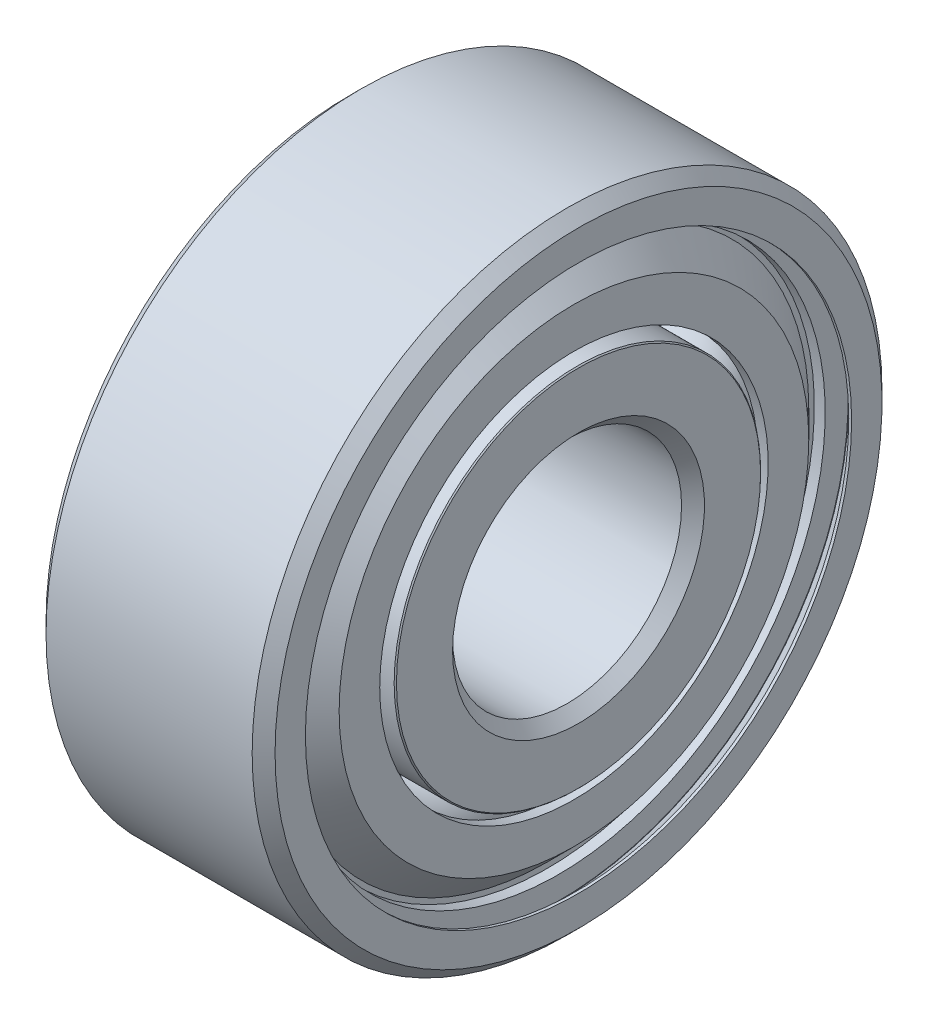
from build123d import *
from build123d.topology import SkipClean

# Parameters (mm, degrees)
SKETCH1_4_W       = 0.19
SKETCH1_4_H       = 0.4
CIRPATTERN2_COUNT = 8


with BuildPart() as part:
    # Sketch1 → Revolve1 (revolve)
    with BuildSketch(Plane.XY, mode=Mode.PRIVATE) as revolve1_sk:
        with BuildLine():
            ThreePointArc((1.00871205, 4.5), (0, 5.05), (-1.00871205, 4.5))
            Line((-1.00871205, 4.5), (-1.25, 4.5))
            Line((-1.25, 4.5), (-1.25, 4.77))
            Line((-1.25, 4.77), (-1.45, 4.77))
            Line((-1.45, 4.77), (-1.45, 5.07))
            Line((-1.45, 5.07), (-1.65, 5.07))
            Line((-1.65, 5.07), (-1.95, 4.77))
            Line((-1.95, 4.77), (-2, 4.77))
            Line((-2, 4.77), (-2, 5.3))
            Line((-2, 5.3), (-1.8, 5.5))
            Line((-1.8, 5.5), (1.8, 5.5))
            Line((1.8, 5.5), (2, 5.3))
            Line((2, 5.3), (2, 4.77))
            Line((2, 4.77), (1.95, 4.77))
            Line((1.95, 4.77), (1.65, 5.07))
            Line((1.65, 5.07), (1.45, 5.07))
            Line((1.45, 5.07), (1.45, 4.77))
            Line((1.45, 4.77), (1.25, 4.77))
            Line((1.25, 4.77), (1.25, 4.5))
            Line((1.25, 4.5), (1.00871205, 4.5))
        make_face()
        with BuildLine():
            ThreePointArc((-1.00871205, 3.2), (0, 2.65), (1.00871205, 3.2))
            Line((1.00871205, 3.2), (1.98, 3.2))
            Line((1.98, 3.2), (2, 3.18))
            Line((2, 3.18), (2, 2.2))
            Line((2, 2.2), (1.8, 2))
            Line((1.8, 2), (-1.8, 2))
            Line((-1.8, 2), (-2, 2.2))
            Line((-2, 2.2), (-2, 3.18))
            Line((-2, 3.18), (-1.98, 3.2))
            Line((-1.98, 3.2), (-1.00871205, 3.2))
        make_face()
    revolve(revolve1_sk.sketch.rotate(Axis((0, 0, 0), (1, 0, 0)), 90), axis=Axis((0, 0, 0), (1, 0, 0)))


with BuildPart() as body_2:
    # Sketch1<3> → Revolve2 (revolve)
    with BuildSketch(Plane.XY, mode=Mode.PRIVATE) as revolve2_sk:
        Polygon((1.92036514, 4.101237783), (1.92036514, 3.392543849), (1.74036514, 3.392543849), (1.74036514, 4.026679342), (1.267044482, 4.5), (1.267044482, 4.756515811), (1.447044482, 4.756515811), (1.447044482, 4.574558441), align=None)
        Polygon((-1.267044482, 4.5), (-1.267044482, 4.756515811), (-1.447044482, 4.756515811), (-1.447044482, 4.574558441), (-1.92036514, 4.101237783), (-1.92036514, 3.392543849), (-1.74036514, 3.392543849), (-1.74036514, 4.026679342), align=None)
    revolve(revolve2_sk.sketch.rotate(Axis((0, 0, 0), (1, 0, 0)), 90), axis=Axis((0, 0, 0), (1, 0, 0)))


with BuildPart() as body_3:
    # Sketch1<4> → Revolve3 (revolve)
    with BuildSketch(Plane.XY, mode=Mode.PRIVATE) as revolve3_sk:
        with Locations((1.553908134, 4.860421419)):
            Rectangle(SKETCH1_4_W, SKETCH1_4_H)
        with Locations((-1.553908134, 4.860421419)):
            Rectangle(SKETCH1_4_W, SKETCH1_4_H)
    revolve(revolve3_sk.sketch.rotate(Axis((0, 0, 0), (1, 0, 0)), 90), axis=Axis((0, 0, 0), (1, 0, 0)))


with BuildPart() as body_4:
    # Sketch1<5> → Revolve4 (revolve)
    with SkipClean():  # the faces are left unmerged after this step: merging them gives an invalid solid
        with BuildSketch(Plane.XY):
            with BuildLine():
                ThreePointArc((1.15, 3.85), (0.813172798, 4.663172798), (0, 5))
                Line((0, 5), (0, 2.7))
                ThreePointArc((0, 2.7), (0.813172798, 3.036827202), (1.15, 3.85))
            make_face()
            with BuildLine():
                Line((0, 2.7), (0, 5))
                ThreePointArc((0, 5), (-1.15, 3.85), (0, 2.7))
            make_face()
        revolve(axis=Axis((0, 5, 0), (0, -1, 0)))


with BuildPart() as cirpattern2_1:
    # CirPattern2: pattern copy
    add(body_4.part.rotate(Axis((0, 0, 0), (1, 0, 0)), 1 * 360 / CIRPATTERN2_COUNT))


with BuildPart() as cirpattern2_2:
    # CirPattern2: pattern copy
    add(body_4.part.rotate(Axis((0, 0, 0), (1, 0, 0)), 2 * 360 / CIRPATTERN2_COUNT))


with BuildPart() as cirpattern2_3:
    # CirPattern2: pattern copy
    add(body_4.part.rotate(Axis((0, 0, 0), (1, 0, 0)), 3 * 360 / CIRPATTERN2_COUNT))


with BuildPart() as cirpattern2_4:
    # CirPattern2: pattern copy
    add(body_4.part.rotate(Axis((0, 0, 0), (1, 0, 0)), 4 * 360 / CIRPATTERN2_COUNT))


with BuildPart() as cirpattern2_5:
    # CirPattern2: pattern copy
    add(body_4.part.rotate(Axis((0, 0, 0), (1, 0, 0)), 5 * 360 / CIRPATTERN2_COUNT))


with BuildPart() as cirpattern2_6:
    # CirPattern2: pattern copy
    add(body_4.part.rotate(Axis((0, 0, 0), (1, 0, 0)), 6 * 360 / CIRPATTERN2_COUNT))


with BuildPart() as cirpattern2_7:
    # CirPattern2: pattern copy
    add(body_4.part.rotate(Axis((0, 0, 0), (1, 0, 0)), 7 * 360 / CIRPATTERN2_COUNT))


solid = Compound([part.part, body_2.part, body_3.part, body_4.part, cirpattern2_1.part, cirpattern2_2.part, cirpattern2_3.part, cirpattern2_4.part, cirpattern2_5.part, cirpattern2_6.part, cirpattern2_7.part])
